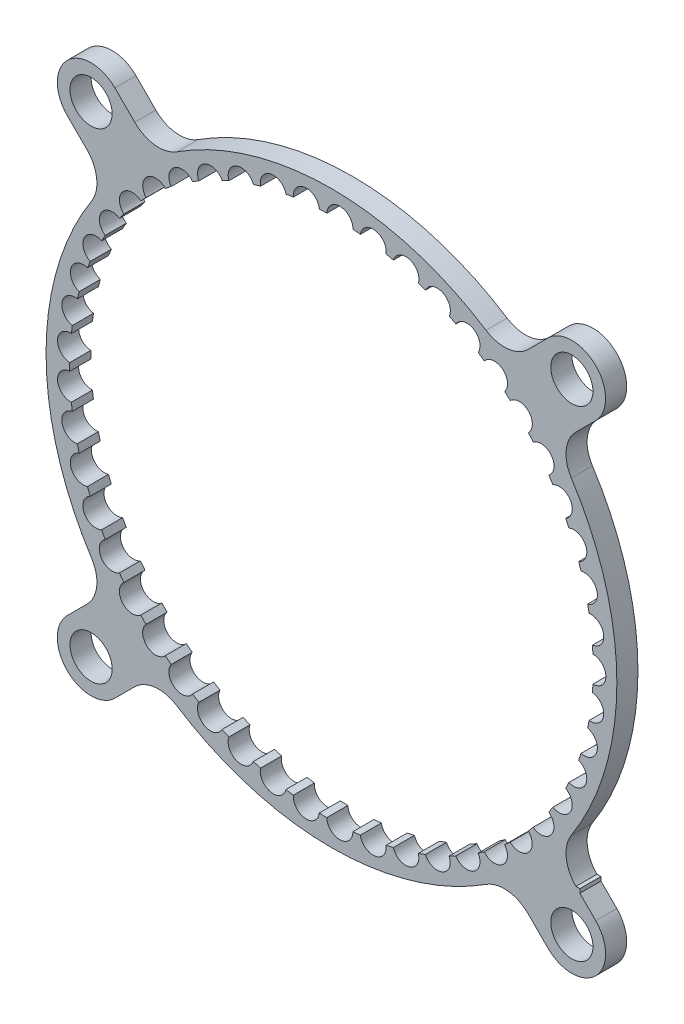
from build123d import *

# Parameters (mm, degrees)
SKETCH_1_R      = 2.5
EXTRUDE_1_DEPTH = 2.5


with BuildPart() as part:
    # 草图1 → 凸台-拉伸1 (new body)
    with BuildSketch(Plane.XY):
        with BuildLine():
            Line((25.671320344, -31.328174593), (23.320064467, -28.976918716))
            ThreePointArc((23.320064467, -28.976918716), (20.916937039, -27.828020085), (18.325216056, -28.442814233))
            ThreePointArc((18.325216056, -28.442814233), (0, -33.835), (-18.325216056, -28.442814233))
            ThreePointArc((-18.325216056, -28.442814233), (-20.916937039, -27.828020085), (-23.320064467, -28.976918716))
            Line((-23.320064467, -28.976918716), (-25.671320344, -31.328174593))
            ThreePointArc((-25.671320344, -31.328174593), (-31.328174593, -31.328174593), (-31.328174593, -25.671320344))
            Line((-31.328174593, -25.671320344), (-28.976918716, -23.320064467))
            ThreePointArc((-28.976918716, -23.320064467), (-27.828020085, -20.916937039), (-28.442814233, -18.325216056))
            ThreePointArc((-28.442814233, -18.325216056), (-33.835, 0), (-28.442814233, 18.325216056))
            ThreePointArc((-28.442814233, 18.325216056), (-27.828020085, 20.916937039), (-28.976918716, 23.320064467))
            Line((-28.976918716, 23.320064467), (-31.328174593, 25.671320344))
            ThreePointArc((-31.328174593, 25.671320344), (-31.328174593, 31.328174593), (-25.671320344, 31.328174593))
            Line((-25.671320344, 31.328174593), (-23.320064467, 28.976918716))
            ThreePointArc((-23.320064467, 28.976918716), (-20.916937039, 27.828020085), (-18.325216056, 28.442814233))
            ThreePointArc((-18.325216056, 28.442814233), (0, 33.835), (18.325216056, 28.442814233))
            ThreePointArc((18.325216056, 28.442814233), (20.916937039, 27.828020085), (23.320064467, 28.976918716))
            Line((23.320064467, 28.976918716), (25.671320344, 31.328174593))
            ThreePointArc((25.671320344, 31.328174593), (31.328174593, 31.328174593), (31.328174593, 25.671320344))
            Line((31.328174593, 25.671320344), (28.976918716, 23.320064467))
            ThreePointArc((28.976918716, 23.320064467), (27.828020085, 20.916937039), (28.442814233, 18.325216056))
            ThreePointArc((28.442814233, 18.325216056), (33.835, 0), (28.442814233, -18.325216056))
            ThreePointArc((28.442814233, -18.325216056), (27.828020085, -20.916937039), (28.976918716, -23.320064467))
            Line((28.976918716, -23.320064467), (29.450279484, -23.320064467))
            Line((29.450279484, -23.320064467), (29.450279484, -23.793425235))
            Line((29.450279484, -23.793425235), (31.328174593, -25.671320344))
            ThreePointArc((31.328174593, -25.671320344), (31.328174593, -31.328174593), (25.671320344, -31.328174593))
        make_face()
        with Locations((28.499747468, -28.499747468)):
            Circle(SKETCH_1_R, mode=Mode.SUBTRACT)
        with Locations((-28.499747468, -28.499747468)):
            Circle(SKETCH_1_R, mode=Mode.SUBTRACT)
        with Locations((-28.499747468, 28.499747468)):
            Circle(SKETCH_1_R, mode=Mode.SUBTRACT)
        with Locations((28.499747468, 28.499747468)):
            Circle(SKETCH_1_R, mode=Mode.SUBTRACT)
        with BuildLine():
            Line((30.967380809, -1.988171813), (30.995571706, -1.54907584))
            ThreePointArc((30.995571706, -1.54907584), (32.086109964, -1.093363959), (32.535, 0))
            ThreePointArc((32.535, 0), (32.082923383, 1.086913605), (30.996191231, 1.539426235))
            Line((30.996191231, 1.539426235), (30.967380809, 1.988171813))
            Line((30.967380809, 1.988171813), (30.939189912, 2.427267786))
            ThreePointArc((30.939189912, 2.427267786), (31.962499724, 3.018693216), (32.2678881, 4.160483455))
            ThreePointArc((32.2678881, 4.160483455), (31.680531599, 5.18066324), (30.544855472, 5.490492524))
            Line((30.544855472, 5.490492524), (30.458897272, 5.931869712))
            Line((30.458897272, 5.931869712), (30.374787475, 6.363755741))
            ThreePointArc((30.374787475, 6.363755741), (31.314066123, 7.081183531), (31.470938369, 8.252651887))
            ThreePointArc((31.470938369, 8.252651887), (30.757946362, 9.189346528), (29.59197403, 9.351405078))
            Line((29.59197403, 9.351405078), (29.450279484, 9.778166475))
            Line((29.450279484, 9.778166475), (29.311631868, 10.195751004))
            ThreePointArc((29.311631868, 10.195751004), (30.151456422, 11.027401009), (30.1572367, 12.209312004))
            ThreePointArc((30.1572367, 12.209312004), (29.330316496, 13.047141), (28.153193193, 13.05876782))
            Line((28.153193193, 13.05876782), (27.958088921, 13.463906015))
            Line((27.958088921, 13.463906015), (27.767180076, 13.860332317))
            ThreePointArc((27.767180076, 13.860332317), (28.493760639, 14.792548867), (28.348354039, 15.965495554))
            ThreePointArc((28.348354039, 15.965495554), (27.421083643, 16.690701777), (26.252137703, 16.551705954))
            Line((26.252137703, 16.551705954), (26.006827311, 16.92856859))
            Line((26.006827311, 16.92856859), (25.766791955, 17.297327356))
            ThreePointArc((25.766791955, 17.297327356), (26.368198095, 18.314803482), (26.073992187, 19.45952611))
            ThreePointArc((26.073992187, 19.45952611), (25.061597356, 20.060201693), (23.920022836, 19.772865535))
            Line((23.920022836, 19.772865535), (23.628534316, 20.115264537))
            Line((23.628534316, 20.115264537), (23.343313822, 20.450300759))
            ThreePointArc((23.343313822, 20.450300759), (23.809670467, 21.536329529), (23.371496105, 22.634031784))
            ThreePointArc((23.371496105, 22.634031784), (22.290600333, 23.100313652), (21.195141857, 22.66935521))
            Line((21.195141857, 22.66935521), (20.86226144, 22.971668396))
            Line((20.86226144, 22.971668396), (20.536539122, 23.267480788))
            ThreePointArc((20.536539122, 23.267480788), (20.860188709, 24.404229642), (20.285240703, 25.436887282))
            ThreePointArc((20.285240703, 25.436887282), (19.153592268, 25.761119099), (18.122237234, 25.193614699))
            Line((18.122237234, 25.193614699), (17.753430809, 25.450878096))
            Line((17.753430809, 25.450878096), (17.392555017, 25.702609426))
            ThreePointArc((17.392555017, 25.702609426), (17.568183228, 26.871412978), (16.86590221, 27.822069794))
            ThreePointArc((16.86590221, 27.822069794), (15.702082748, 27.998927682), (14.751765976, 27.304195731))
            Line((14.751765976, 27.304195731), (14.353089334, 27.51218508))
            Line((14.353089334, 27.51218508), (13.962985639, 27.715701928))
            ThreePointArc((13.962985639, 27.715701928), (13.987708665, 28.897368456), (13.169626068, 29.75041469))
            ThreePointArc((13.169626068, 29.75041469), (11.992745464, 29.776994647), (11.139071129, 28.966442625))
            Line((11.139071129, 28.966442625), (10.717070529, 29.121742746))
            Line((10.717070529, 29.121742746), (10.304144423, 29.27370337))
            ThreePointArc((10.304144423, 29.27370337), (10.177556312, 30.448829943), (9.257105031, 31.190258599))
            ThreePointArc((9.257105031, 31.190258599), (8.08648763, 31.066124184), (7.343473042, 30.153061331))
            Line((7.343473042, 30.153061331), (6.905077723, 30.253122202))
            Line((6.905077723, 30.253122202), (6.476109441, 30.351031413))
            ThreePointArc((6.476109441, 30.351031413), (6.200288765, 31.500322484), (5.192582585, 32.117959323))
            ThreePointArc((5.192582585, 32.117959323), (4.047449894, 31.84514882), (3.427295331, 30.844567604))
            Line((3.427295331, 30.844567604), (2.979703731, 30.887746227))
            Line((2.979703731, 30.887746227), (2.541736921, 30.929996359))
            ThreePointArc((2.541736921, 30.929996359), (2.121212649, 32.034580601), (1.042798076, 32.518284044))
            ThreePointArc((1.042798076, 32.518284044), (-0.058046858, 32.101276993), (-0.545158475, 31.029606929))
            Line((-0.545158475, 31.029606929), (-0.994596914, 31.015194313))
            Line((-0.994596914, 31.015194313), (-1.434370849, 31.001091619))
            ThreePointArc((-1.434370849, 31.001091619), (-1.992693721, 32.04283179), (-3.124109148, 32.38465944))
            ThreePointArc((-3.124109148, 32.38465944), (-4.162590483, 31.830303085), (-4.508660794, 30.705140967))
            Line((-4.508660794, 30.705140967), (-4.952566305, 30.633373766))
            Line((-4.952566305, 30.633373766), (-5.38692629, 30.563149813))
            ThreePointArc((-5.38692629, 30.563149813), (-6.073880114, 31.524940566), (-7.239718586, 31.719279623))
            ThreePointArc((-7.239718586, 31.719279623), (-8.198784487, 31.03667648), (-8.398131027, 29.876497439))
            Line((-8.398131027, 29.876497439), (-8.829214694, 29.748554069))
            Line((-8.829214694, 29.748554069), (-9.25102855, 29.623361931))
            ThreePointArc((-9.25102855, 29.623361931), (-10.055333565, 30.489410691), (-11.236452046, 30.533070111))
            ThreePointArc((-11.236452046, 30.533070111), (-12.100354676, 29.733428506), (-12.149704181, 28.557282649))
            Line((-12.149704181, 28.557282649), (-12.560887622, 28.375263936))
            Line((-12.560887622, 28.375263936), (-12.963229176, 28.197159265))
            ThreePointArc((-12.963229176, 28.197159265), (-13.871678716, 28.953245534), (-15.048683273, 28.845508433))
            ThreePointArc((-15.048683273, 28.845508433), (-15.803237376, 27.941958458), (-15.701779528, 26.769158067))
            Line((-15.701779528, 26.769158067), (-16.086311123, 26.536052754))
            Line((-16.086311123, 26.536052754), (-16.462573939, 26.307960024))
            ThreePointArc((-16.462573939, 26.307960024), (-17.460251286, 26.941668887), (-18.613815537, 26.684304303))
            ThreePointArc((-18.613815537, 26.684304303), (-19.246631355, 25.691682224), (-18.996032089, 24.54148465))
            Line((-18.996032089, 24.54148465), (-19.347597839, 24.26112032))
            Line((-19.347597839, 24.26112032), (-19.691603692, 23.986784807))
            ThreePointArc((-19.691603692, 23.986784807), (-20.762127012, 24.487710781), (-21.873309465, 24.084944635))
            ThreePointArc((-21.873309465, 24.084944635), (-22.373996179, 23.019549278), (-21.978370329, 21.910840733))
            Line((-21.978370329, 21.910840733), (-22.291197534, 21.58782096))
            Line((-22.291197534, 21.58782096), (-22.597297857, 21.271747246))
            ThreePointArc((-22.597297857, 21.271747246), (-23.723089187, 21.631665141), (-24.773644256, 21.090110841))
            ThreePointArc((-24.773644256, 21.090110841), (-25.133980605, 19.96943597), (-24.599824335, 18.920421417))
            Line((-24.599824335, 18.920421417), (-24.868776382, 18.560050177))
            Line((-24.868776382, 18.560050177), (-25.131945015, 18.207428184))
            ThreePointArc((-25.131945015, 18.207428184), (-26.294518894, 18.420428158), (-27.267196493, 17.748978011))
            ThreePointArc((-27.267196493, 17.748978011), (-27.481265764, 16.591425075), (-26.817349906, 15.619329305))
            Line((-26.817349906, 15.619329305), (-27.038010609, 15.227523883))
            Line((-27.038010609, 15.227523883), (-27.253926332, 14.844143654))
            ThreePointArc((-27.253926332, 14.844143654), (-28.434193327, 14.906728253), (-29.313022117, 14.116407452))
            ThreePointArc((-29.313022117, 14.116407452), (-29.377309298, 12.940983439), (-28.594535333, 12.061768238))
            Line((-28.594535333, 12.061768238), (-28.763281449, 11.644962069))
            Line((-28.763281449, 11.644962069), (-28.928398932, 11.237118695))
            ThreePointArc((-28.928398932, 11.237118695), (-30.106979092, 11.148260283), (-30.877528729, 10.252045873))
            ThreePointArc((-30.877528729, 10.252045873), (-30.790978227, 9.078051213), (-29.902199281, 8.306153269))
            Line((-29.902199281, 8.306153269), (-30.016260004, 7.871190298))
            Line((-30.016260004, 7.871190298), (-30.127868021, 7.445580559))
            ThreePointArc((-30.127868021, 7.445580559), (-31.285409092, 7.206738187), (-31.935027173, 6.219345985))
            ThreePointArc((-31.935027173, 6.219345985), (-31.699060144, 5.066057637), (-30.718869943, 4.414151493))
            Line((-30.718869943, 4.414151493), (-30.776372398, 3.968173801))
            Line((-30.776372398, 3.968173801), (-30.832638349, 3.531786195))
            ThreePointArc((-30.832638349, 3.531786195), (-31.95013354, 3.146881649), (-32.468153353, 2.084524607))
            ThreePointArc((-32.468153353, 2.084524607), (-32.08664437, 0.970879535), (-31.031137609, 0.449669472))
            Line((-31.031137609, 0.449669472), (-31.031137609, 0))
            Line((-31.031137609, 0), (-31.031137609, -0.44))
            ThreePointArc((-31.031137609, -0.44), (-32.090237679, -0.964646598), (-32.468153353, -2.084524607))
            ThreePointArc((-32.468153353, -2.084524607), (-31.947366782, -3.140240383), (-30.833874854, -3.522196109))
            Line((-30.833874854, -3.522196109), (-30.776372398, -3.968173801))
            Line((-30.776372398, -3.968173801), (-30.720106447, -4.404561407))
            ThreePointArc((-30.720106447, -4.404561407), (-31.703421002, -5.060335375), (-31.935027173, -6.219345985))
            ThreePointArc((-31.935027173, -6.219345985), (-31.283514316, -7.19979764), (-30.130320726, -7.436227328))
            Line((-30.130320726, -7.436227328), (-30.016260004, -7.871190298))
            Line((-30.016260004, -7.871190298), (-29.904651987, -8.296800038))
            ThreePointArc((-29.904651987, -8.296800038), (-30.796035029, -9.072933585), (-30.877528729, -10.252045873))
            ThreePointArc((-30.877528729, -10.252045873), (-30.105987409, -11.141134419), (-28.932027565, -11.2281559))
            Line((-28.932027565, -11.2281559), (-28.763281449, -11.644962069))
            Line((-28.763281449, -11.644962069), (-28.598163967, -12.052805442))
            ThreePointArc((-28.598163967, -12.052805442), (-29.382979012, -12.936554477), (-29.313022117, -14.116407452))
            ThreePointArc((-29.313022117, -14.116407452), (-28.434121021, -14.899534079), (-27.258671312, -14.835718462))
            Line((-27.258671312, -14.835718462), (-27.038010609, -15.227523883))
            Line((-27.038010609, -15.227523883), (-26.822094886, -15.610904113))
            ThreePointArc((-26.822094886, -15.610904113), (-27.487455292, -16.587757501), (-27.267196493, -17.748978011))
            ThreePointArc((-27.267196493, -17.748978011), (-26.295367152, -18.413283801), (-25.137728429, -18.199678937))
            Line((-25.137728429, -18.199678937), (-24.868776382, -18.560050177))
            Line((-24.868776382, -18.560050177), (-24.605607749, -18.912672171))
            ThreePointArc((-24.605607749, -18.912672171), (-25.140588316, -19.966590006), (-24.773644256, -21.090110841))
            ThreePointArc((-24.773644256, -21.090110841), (-23.724844081, -21.624687913), (-22.60402474, -21.264801187))
            Line((-22.60402474, -21.264801187), (-22.291197534, -21.58782096))
            Line((-22.291197534, -21.58782096), (-21.985097212, -21.903894674))
            ThreePointArc((-21.985097212, -21.903894674), (-22.380913575, -23.017571655), (-21.873309465, -24.084944635))
            ThreePointArc((-21.873309465, -24.084944635), (-20.764759726, -24.481015246), (-19.699163589, -23.98075599))
            Line((-19.699163589, -23.98075599), (-19.347597839, -24.26112032))
            Line((-19.347597839, -24.26112032), (-19.003591987, -24.535455832))
            ThreePointArc((-19.003591987, -24.535455832), (-19.253744852, -25.690605414), (-18.613815537, -26.684304303))
            ThreePointArc((-18.613815537, -26.684304303), (-17.463718591, -26.935364987), (-16.470842718, -26.302947442))
            Line((-16.470842718, -26.302947442), (-16.086311123, -26.536052754))
            Line((-16.086311123, -26.536052754), (-15.710048307, -26.764145484))
            ThreePointArc((-15.710048307, -26.764145484), (-15.810430171, -27.941800142), (-15.048683273, -28.845508433))
            ThreePointArc((-15.048683273, -28.845508433), (-13.87592368, -28.947436778), (-12.972071064, -28.193245224))
            Line((-12.972071064, -28.193245224), (-12.560887622, -28.375263936))
            Line((-12.560887622, -28.375263936), (-12.158546068, -28.553368607))
            ThreePointArc((-12.158546068, -28.553368607), (-12.107508663, -29.734191284), (-11.236452046, -30.533070111))
            ThreePointArc((-11.236452046, -30.533070111), (-10.060286485, -30.484192458), (-9.260298362, -29.620610699))
            Line((-9.260298362, -29.620610699), (-8.829214694, -29.748554069))
            Line((-8.829214694, -29.748554069), (-8.407400839, -29.873746207))
            ThreePointArc((-8.407400839, -29.873746207), (-8.205782198, -31.038347828), (-7.239718586, -31.719279623))
            ThreePointArc((-7.239718586, -31.719279623), (-6.079459664, -31.520398541), (-5.396471817, -30.561606566))
            Line((-5.396471817, -30.561606566), (-4.952566305, -30.633373766))
            Line((-4.952566305, -30.633373766), (-4.51820632, -30.70359772))
            ThreePointArc((-4.51820632, -30.70359772), (-4.169317016, -31.832855558), (-3.124109148, -32.38465944))
            ThreePointArc((-3.124109148, -32.38465944), (-1.998808284, -32.039040551), (-1.444035353, -31.000781697))
            Line((-1.444035353, -31.000781697), (-0.994596914, -31.015194313))
            Line((-0.994596914, -31.015194313), (-0.554822979, -31.029297008))
            ThreePointArc((-0.554822979, -31.029297008), (-0.064391764, -32.10466868), (1.042798076, -32.518284044))
            ThreePointArc((1.042798076, -32.518284044), (2.114663474, -32.031602401), (2.53211213, -30.930924851))
            Line((2.53211213, -30.930924851), (2.979703731, -30.887746227))
            Line((2.979703731, -30.887746227), (3.41767054, -30.845496096))
            ThreePointArc((3.41767054, -30.845496096), (4.041590799, -31.84932403), (5.192582585, -32.117959323))
            ThreePointArc((5.192582585, -32.117959323), (6.193412515, -31.498206225), (6.466682403, -30.353183073))
            Line((6.466682403, -30.353183073), (6.905077723, -30.253122202))
            Line((6.905077723, -30.253122202), (7.334046004, -30.155212991))
            ThreePointArc((7.334046004, -30.155212991), (8.081210553, -31.07101436), (9.257105031, -31.190258599))
            ThreePointArc((9.257105031, -31.190258599), (10.170465894, -30.447610374), (10.295069929, -29.277042868))
            Line((10.295069929, -29.277042868), (10.717070529, -29.121742746))
            Line((10.717070529, -29.121742746), (11.129996635, -28.969782123))
            ThreePointArc((11.129996635, -28.969782123), (11.988137053, -29.782519493), (13.169626068, -29.75041469))
            ThreePointArc((13.169626068, -29.75041469), (13.980520504, -28.897065602), (13.954412692, -27.720174429))
            Line((13.954412692, -27.720174429), (14.353089334, -27.51218508))
            Line((14.353089334, -27.51218508), (14.743193029, -27.308668233))
            ThreePointArc((14.743193029, -27.308668233), (15.698218674, -28.004996479), (16.86590221, -27.822069794))
            ThreePointArc((16.86590221, -27.822069794), (17.561015355, -26.872031812), (17.384624384, -25.708141492))
            Line((17.384624384, -25.708141492), (17.753430809, -25.450878096))
            Line((17.753430809, -25.450878096), (18.114306601, -25.199146765))
            ThreePointArc((18.114306601, -25.199146765), (19.150535979, -25.767632198), (20.285240703, -25.436887282))
            ThreePointArc((20.285240703, -25.436887282), (20.853158818, -24.405760003), (20.529381024, -23.273981583))
            Line((20.529381024, -23.273981583), (20.86226144, -22.971668396))
            Line((20.86226144, -22.971668396), (21.187983759, -22.675856005))
            ThreePointArc((21.187983759, -22.675856005), (22.288402012, -23.107164108), (23.371496105, -22.634031784))
            ThreePointArc((23.371496105, -22.634031784), (23.80289399, -21.538746289), (23.337045796, -20.457663539))
            Line((23.337045796, -20.457663539), (23.628534316, -20.115264537))
            Line((23.628534316, -20.115264537), (23.91375481, -19.780228315))
            ThreePointArc((23.91375481, -19.780228315), (25.0602931, -20.067277022), (26.073992187, -19.45952611))
            ThreePointArc((26.073992187, -19.45952611), (26.361786301, -18.318066956), (25.76151692, -17.305431226))
            Line((25.76151692, -17.305431226), (26.006827311, -16.92856859))
            Line((26.006827311, -16.92856859), (26.246862668, -16.559809824))
            ThreePointArc((26.246862668, -16.559809824), (27.420694869, -16.697885803), (28.348354039, -15.965495554))
            ThreePointArc((28.348354039, -15.965495554), (28.48781881, -14.79660547), (27.762984649, -13.86904421))
            Line((27.762984649, -13.86904421), (27.958088921, -13.463906015))
            Line((27.958088921, -13.463906015), (28.148997767, -13.067479713))
            ThreePointArc((28.148997767, -13.067479713), (29.330849585, -13.05431576), (30.1572367, -12.209312004))
            ThreePointArc((30.1572367, -12.209312004), (30.146082121, -11.032184132), (29.308584938, -10.204927872))
            Line((29.308584938, -10.204927872), (29.450279484, -9.778166475))
            Line((29.450279484, -9.778166475), (29.5889271, -9.360581947))
            ThreePointArc((29.5889271, -9.360581947), (30.759392563, -9.196394213), (31.470938369, -8.252651887))
            ThreePointArc((31.470938369, -8.252651887), (31.309347598, -7.086614635), (30.372939072, -6.3732469))
            Line((30.372939072, -6.3732469), (30.458897272, -5.931869712))
            Line((30.458897272, -5.931869712), (30.543007069, -5.499983683))
            ThreePointArc((30.543007069, -5.499983683), (31.682867165, -5.187468128), (32.2678881, -4.160483455))
            ThreePointArc((32.2678881, -4.160483455), (31.958514452, -3.024683122), (30.938570387, -2.436917391))
            Line((30.938570387, -2.436917391), (30.967380809, -1.988171813))
        make_face(mode=Mode.SUBTRACT)
    extrude(amount=EXTRUDE_1_DEPTH)


solid = part.part
